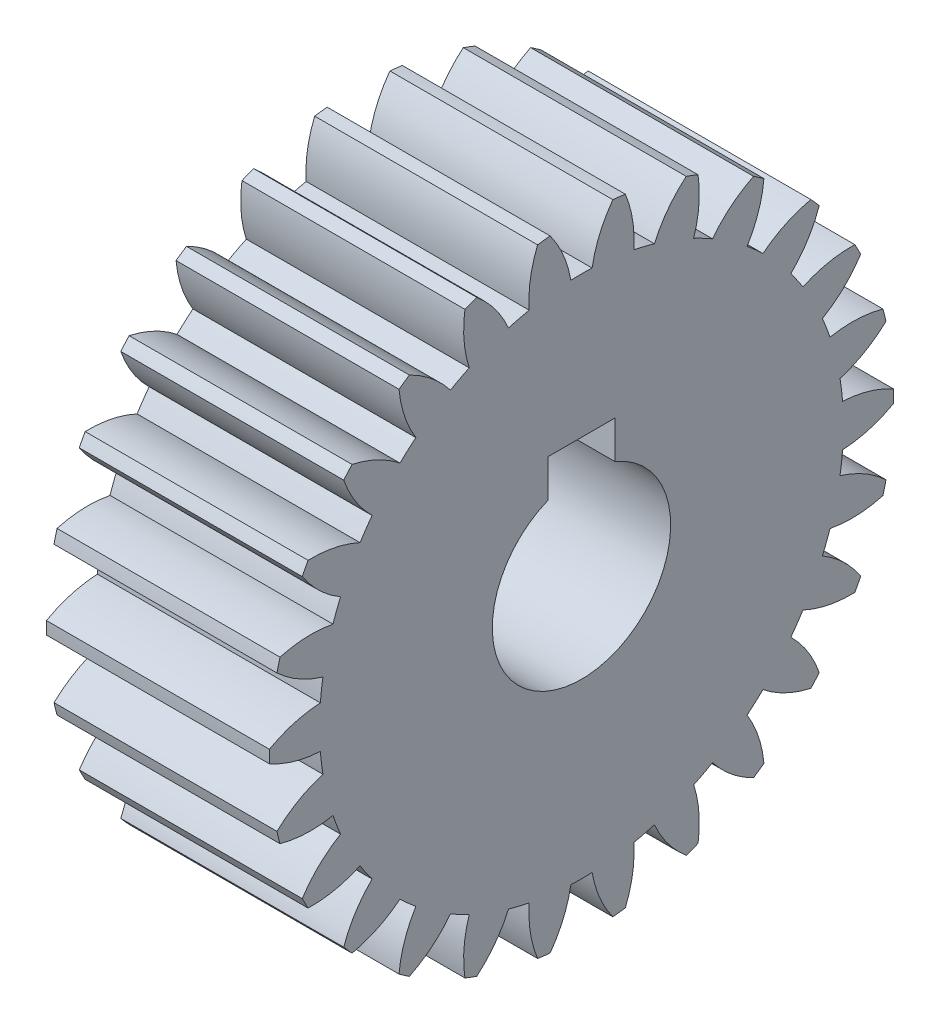
from build123d import *

# Parameters (mm, degrees)
BASPROSKE_W     = 10
BASPROSKE_H     = 14
TOOTHCUT_DEPTH  = 23.181073013
TEETHCUTS_COUNT = 26
TEETHCUTS_ANGLE = 346.153846154
BORSKE_R        = 4
BORE_DEPTH      = 50.0000508
KEYSKE_W        = 3
KEYSKE_H        = 5.4
KEYWAY_DEPTH    = 50.0000508


with BuildPart() as part:
    # BasProSke → Base-Revolve (revolve)
    with BuildSketch(Plane(origin=(0, 0, 0), x_dir=(1, 0, 0), z_dir=(0, 1, 0)), mode=Mode.PRIVATE) as base_revolve_sk:
        with Locations((5, 7)):
            Rectangle(BASPROSKE_W, BASPROSKE_H)
    revolve(base_revolve_sk.sketch.rotate(Axis((-10, 0, 0), (1, 0, 0)), 180), axis=Axis((-10, 0, 0), (1, 0, 0)))

    # TooCutSke → ToothCut (cut, through all)
    with BuildSketch(Plane(origin=(0, 0, 0), x_dir=(0, 0, -1), z_dir=(1, 0, 0))):
        with BuildLine():
            ThreePointArc((0.476965065, 11.739314517), (0, 11.749), (-0.476965065, 11.739314517))
            ThreePointArc((-0.476965065, 11.739314517), (-0.82065865, 12.901686978), (-1.424117301, 13.952911348))
            ThreePointArc((-1.424117301, 13.952911348), (0, 14.0254), (1.424117301, 13.952911348))
            ThreePointArc((1.424117301, 13.952911348), (0.82065865, 12.901686978), (0.476965065, 11.739314517))
        make_face()
    toothcut = extrude(amount=TOOTHCUT_DEPTH, mode=Mode.SUBTRACT)

    # TeethCuts: ToothCut ×26 about axis
    teethcuts_axis = Axis((-10, 0, 0), (1, 0, 0))
    for i in range(1, TEETHCUTS_COUNT):
        add(toothcut.rotate(teethcuts_axis, i * TEETHCUTS_ANGLE / (TEETHCUTS_COUNT - 1)), mode=Mode.SUBTRACT)

    # BorSke → Bore (cut, symmetric)
    with BuildSketch(Plane(origin=(0, 0, 0), x_dir=(0, 0, -1), z_dir=(1, 0, 0))):
        with Locations(Location((0, 0, 0), (0, 0, 180))):
            Circle(BORSKE_R)
    extrude(amount=BORE_DEPTH, both=True, mode=Mode.SUBTRACT)

    # KeySke → Keyway (cut, symmetric)
    with BuildSketch(Plane(origin=(0, 0, 0), x_dir=(0, 0, -1), z_dir=(1, 0, 0))):
        with Locations((0, 2.7)):
            Rectangle(KEYSKE_W, KEYSKE_H)
    extrude(amount=KEYWAY_DEPTH, both=True, mode=Mode.SUBTRACT)


solid = part.part
